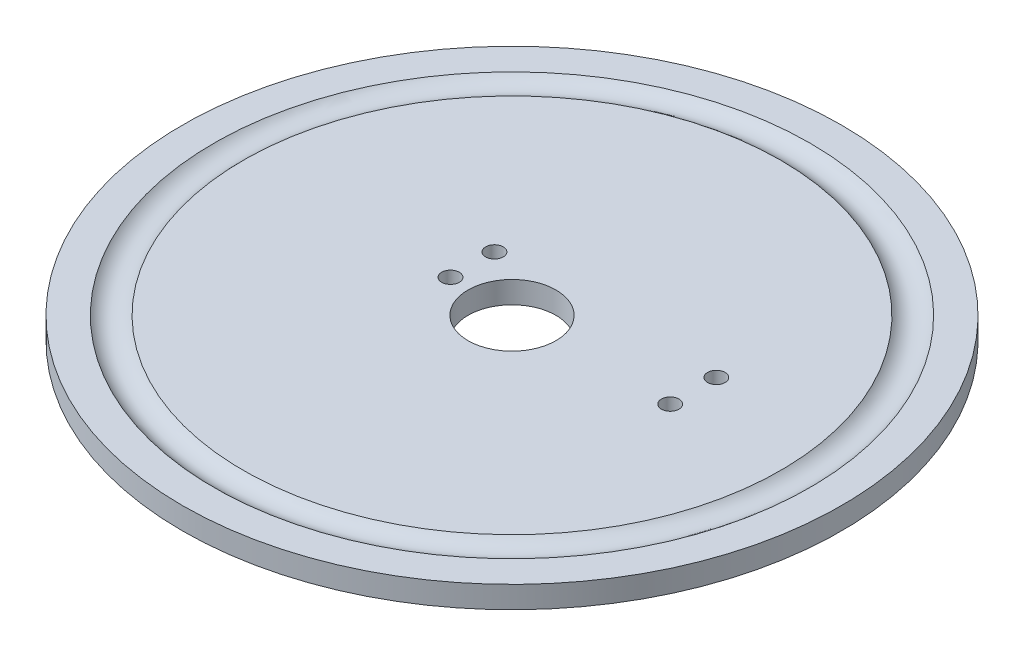
from build123d import *

# Parameters (mm, degrees)
CROQUIS1_R              = 75
SALIENTE_EXTRUIR1_DEPTH = 2.5
CROQUIS2_R              = 10
CORTAR_EXTRUIR1_DEPTH   = 5
CROQUIS5_R              = 4.5
CROQUIS3_R              = 2
CORTAR_EXTRUIR4_DEPTH   = 5


with BuildPart() as part:
    # Croquis1 → Saliente-Extruir1 (new, symmetric)
    with BuildSketch(Plane(origin=(0, 0, 0), x_dir=(1, 0, 0), z_dir=(0, 1, 0))):
        with Locations(Location((0, 0, 0), (0, 0, 270))):
            Circle(CROQUIS1_R)
    extrude(amount=SALIENTE_EXTRUIR1_DEPTH, both=True)

    # Croquis2 → Cortar-Extruir1 (cut)
    with BuildSketch(Plane(origin=(0, 2.5, 0), x_dir=(1, 0, 0), z_dir=(0, 1, 0))):
        with Locations(Location((0, 0, 0), (0, 0, 270))):
            Circle(CROQUIS2_R)
    extrude(amount=-CORTAR_EXTRUIR1_DEPTH, mode=Mode.SUBTRACT)

    # Cortar-Barrer1: sweep along a path in Croquis4
    with BuildLine(Plane(origin=(0, 2.5, 0), x_dir=(1, 0, 0), z_dir=(0, 1, 0))) as cortar_barrer1_path:
        CenterArc((0, 0), 64.5, 0, 360)
    # Croquis5 → Cortar-Barrer1 (sweep, cut)
    with BuildSketch(Plane(origin=(0, 0, 0), x_dir=(0, 0, -1), z_dir=(1, 0, 0))):
        with Locations((64.5, 5.5)):
            Circle(CROQUIS5_R)
    sweep(path=cortar_barrer1_path.line, mode=Mode.SUBTRACT)

    # Croquis3 → Cortar-Extruir4 (cut)
    with BuildSketch(Plane(origin=(0, 2.5, 0), x_dir=(1, 0, 0), z_dir=(0, 1, 0))):
        with Locations(Location((-14.5, 10.5, 0), (0, 0, 270))):
            Circle(CROQUIS3_R)
        with Locations(Location((-14.5, 0.5, 0), (0, 0, 270))):
            Circle(CROQUIS3_R)
        with Locations(Location((35.5, 11, 0), (0, 0, 270))):
            Circle(CROQUIS3_R)
        with Locations(Location((35.5, 0.5, 0), (0, 0, 270))):
            Circle(CROQUIS3_R)
    extrude(amount=-CORTAR_EXTRUIR4_DEPTH, mode=Mode.SUBTRACT)


solid = part.part
